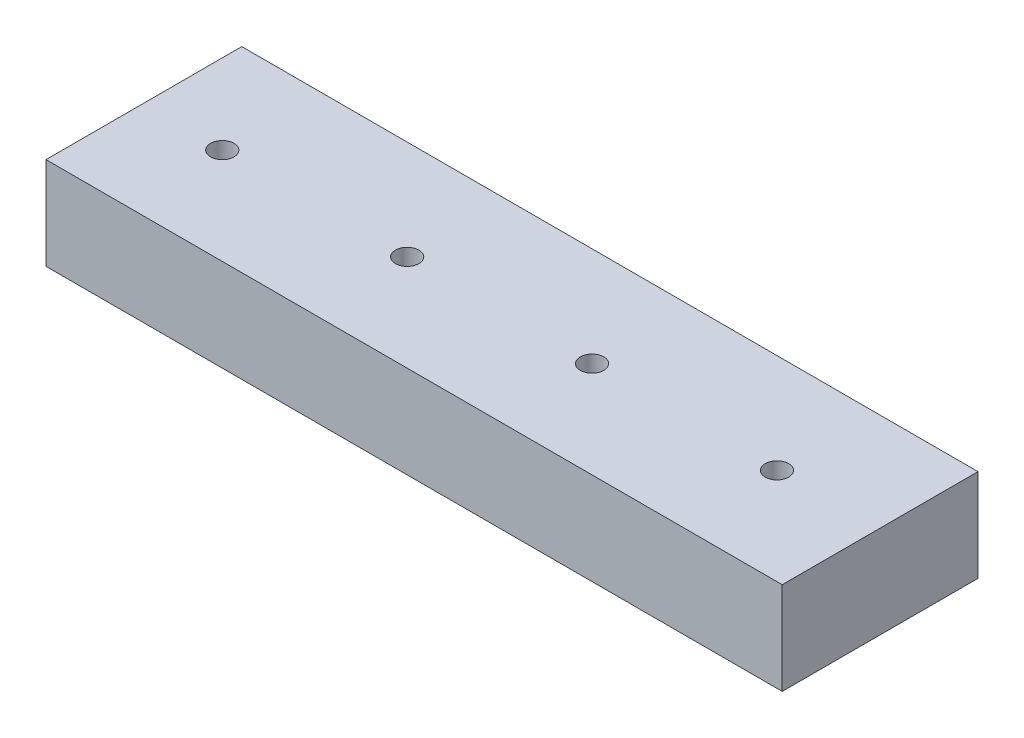
from build123d import *

# Parameters (mm, degrees)
SKETCH1_W           = 79.633875738
SKETCH1_H           = 21.178520391
SKETCH1_R           = 1.27
BOSS_EXTRUDE1_DEPTH = 10


with BuildPart() as part:
    # Sketch1 → Boss-Extrude1 (new body)
    with BuildSketch(Plane(origin=(0, 0, 0), x_dir=(1, 0, 0), z_dir=(0, 1, 0))):
        with Locations((11.173643964, 0.164941747)):
            Rectangle(SKETCH1_W, SKETCH1_H)
        with Locations(Location((0, 0, 0), (0, 0, 270))):
            Circle(SKETCH1_R, mode=Mode.SUBTRACT)
        with Locations(Location((-20, 0, 0), (0, 0, 270))):
            Circle(SKETCH1_R, mode=Mode.SUBTRACT)
        with Locations(Location((20, 0, 0), (0, 0, 270))):
            Circle(SKETCH1_R, mode=Mode.SUBTRACT)
        with Locations(Location((40, 0, 0), (0, 0, 270))):
            Circle(SKETCH1_R, mode=Mode.SUBTRACT)
    extrude(amount=BOSS_EXTRUDE1_DEPTH)


solid = part.part
